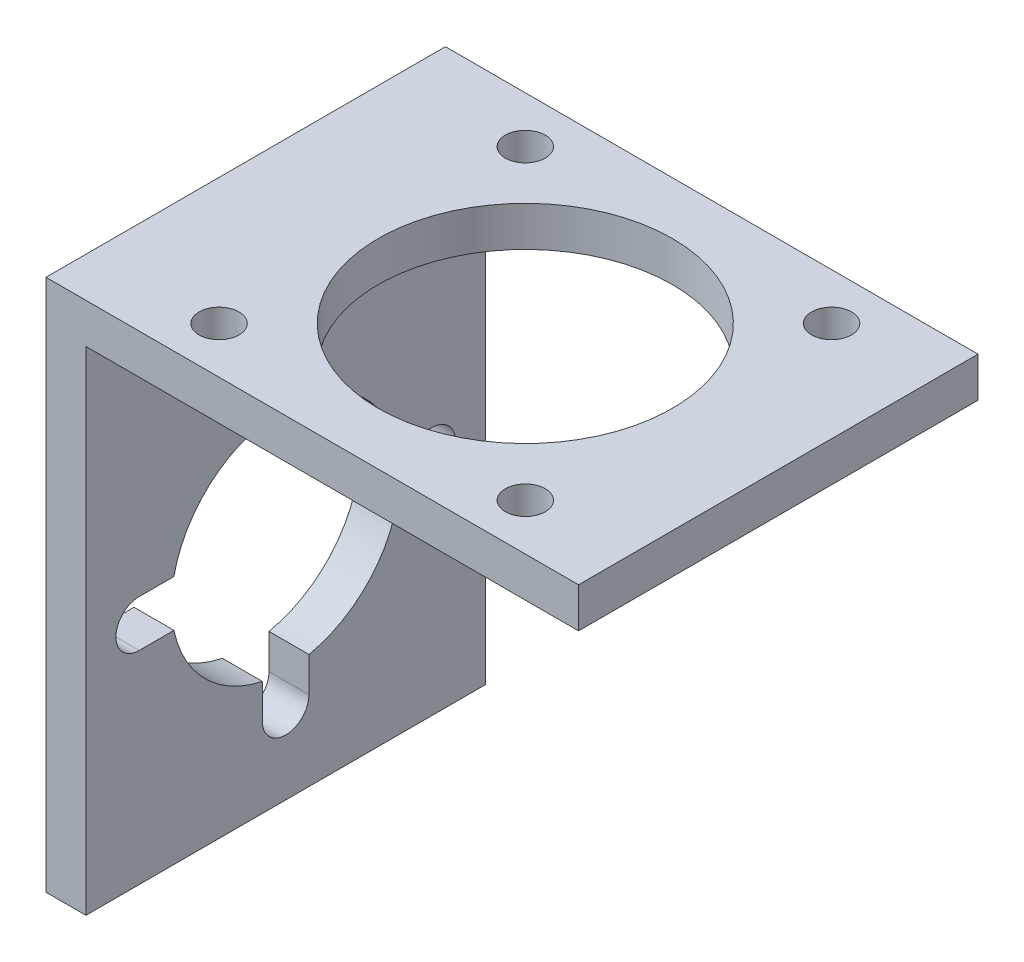
from build123d import *

# Parameters (mm, degrees)
BOSS_EXTRUDE1_DEPTH = 30
SKETCH2_R           = 11.05
SKETCH2_R_2         = 1.5
CUT_EXTRUDE1_DEPTH  = 63.20128616
CUT_EXTRUDE2_DEPTH  = 63.20128616


with BuildPart() as part:
    # Sketch1 → Boss-Extrude1 (new body)
    with BuildSketch(Plane.XY):
        Polygon((0, 0), (40, 0), (40, -3), (3, -3), (3, -40), (0, -40), (0, -3), align=None)
    extrude(amount=BOSS_EXTRUDE1_DEPTH)

    # Sketch2 → Cut-Extrude1 (cut, through all)
    with BuildSketch(Plane.XZ.offset(3)):
        with Locations(Location((21, 15, 0), (0, 0, 270))):
            Circle(SKETCH2_R)
        with Locations(Location((32.502183488, 26.5, 0), (0, 0, 270))):
            Circle(SKETCH2_R_2)
        with Locations(Location((32.5, 3.497816512, 0), (0, 0, 270))):
            Circle(SKETCH2_R_2)
        with Locations(Location((9.497816512, 3.5, 0), (0, 0, 270))):
            Circle(SKETCH2_R_2)
        with Locations(Location((9.5, 26.502183488, 0), (0, 0, 270))):
            Circle(SKETCH2_R_2)
    extrude(amount=-CUT_EXTRUDE1_DEPTH, mode=Mode.SUBTRACT)

    # Sketch3 → Cut-Extrude2 (cut, through all)
    with BuildSketch(Plane(origin=(3, 0, 0), x_dir=(0, 0, -1), z_dir=(1, 0, 0))):
        with BuildLine():
            Line((-26, -21.27), (-23.389421911, -21.27))
            ThreePointArc((-23.389421911, -21.27), (-21.059905115, -16.960094885), (-16.75, -14.630578089))
            Line((-16.75, -14.630578089), (-16.75, -12.02))
            ThreePointArc((-16.75, -12.02), (-15, -10.27), (-13.25, -12.02))
            Line((-13.25, -12.02), (-13.25, -14.630578089))
            ThreePointArc((-13.25, -14.630578089), (-8.940094885, -16.960094885), (-6.610578089, -21.27))
            Line((-6.610578089, -21.27), (-4, -21.27))
            ThreePointArc((-4, -21.27), (-2.25, -23.02), (-4, -24.77))
            Line((-4, -24.77), (-6.610578089, -24.77))
            ThreePointArc((-6.610578089, -24.77), (-8.940094885, -29.079905115), (-13.25, -31.409421911))
            Line((-13.25, -31.409421911), (-13.25, -34.02))
            ThreePointArc((-13.25, -34.02), (-15, -35.77), (-16.75, -34.02))
            Line((-16.75, -34.02), (-16.75, -31.409421911))
            ThreePointArc((-16.75, -31.409421911), (-21.059905115, -29.079905115), (-23.389421911, -24.77))
            Line((-23.389421911, -24.77), (-26, -24.77))
            ThreePointArc((-26, -24.77), (-27.75, -23.02), (-26, -21.27))
        make_face()
    extrude(amount=-CUT_EXTRUDE2_DEPTH, mode=Mode.SUBTRACT)


solid = part.part
